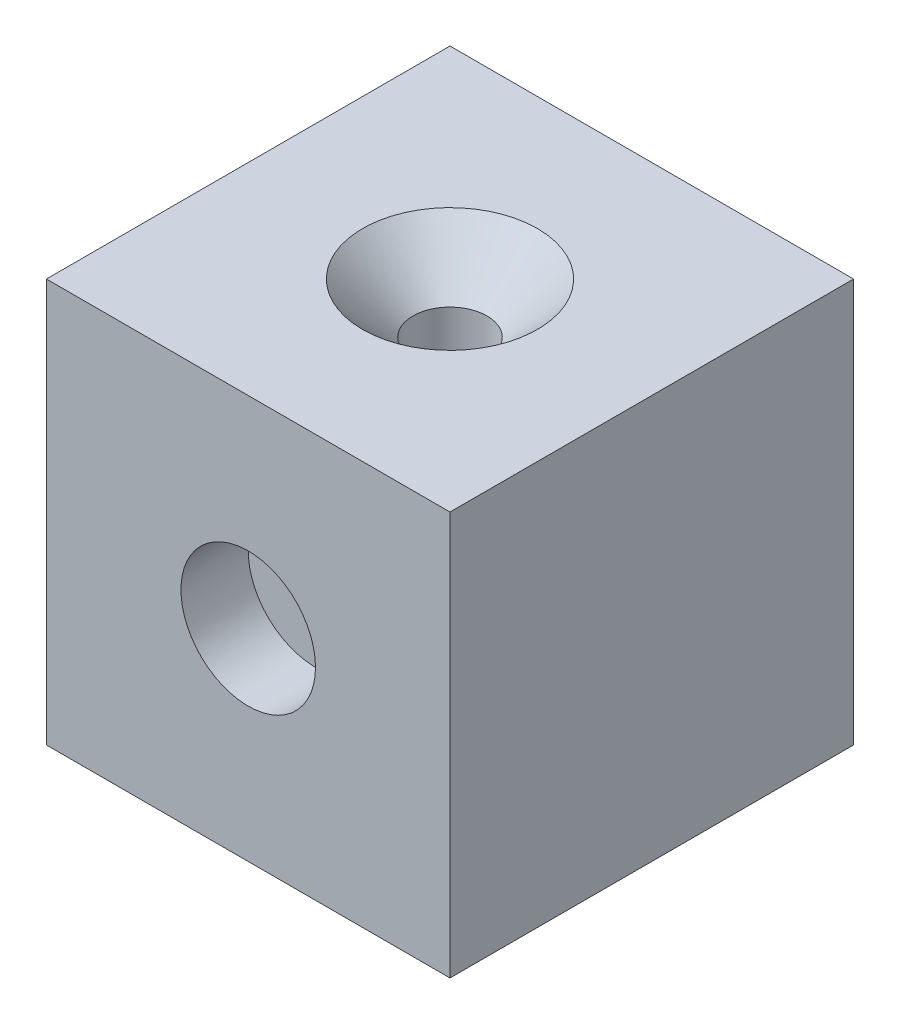
from build123d import *

# Parameters (mm, degrees)
SKETCH1_W           = 152.4
SKETCH1_H           = 152.4
BOSS_EXTRUDE1_DEPTH = 76.2
SKETCH4_R           = 25.4
CUT_EXTRUDE2_DEPTH  = 25.4
SKETCH5_R           = 25.4
BOSS_EXTRUDE2_DEPTH = 25.4
SKETCH6_W           = 127
SKETCH6_H           = 127
CUT_EXTRUDE3_DEPTH  = 12.7


with BuildPart() as part:
    # Sketch1 → Boss-Extrude1 (new, symmetric)
    with BuildSketch(Plane(origin=(0, 0, 0), x_dir=(1, 0, 0), z_dir=(0, 1, 0))):
        Rectangle(SKETCH1_W, SKETCH1_H)
    extrude(amount=BOSS_EXTRUDE1_DEPTH, both=True)

    # Sketch2 → Cut-Revolve1 (revolve, cut)
    with BuildSketch(Plane.XY, mode=Mode.PRIVATE) as cut_revolve1_sk:
        Polygon((0, 12.7), (13.97, 12.7), (13.97, 57.15), (33.02, 76.2), (0, 76.2), align=None)
    revolve(cut_revolve1_sk.sketch.rotate(Axis((0, 0, 0), (0, 1, 0)), 90), axis=Axis((0, 0, 0), (0, 1, 0)), mode=Mode.SUBTRACT)

    # Sketch4 → Cut-Extrude2 (cut)
    with BuildSketch(Plane.XY.offset(76.2)):
        Circle(SKETCH4_R)
    extrude(amount=-CUT_EXTRUDE2_DEPTH, mode=Mode.SUBTRACT)

    # Sketch5 → Boss-Extrude2 (add)
    with BuildSketch(Plane(origin=(0, 0, -76.2), x_dir=(-1, 0, 0), z_dir=(0, 0, -1))):
        with Locations(Location((0, 0, 0), (0, 0, 180))):
            Circle(SKETCH5_R)
    extrude(amount=BOSS_EXTRUDE2_DEPTH)

    # Sketch6 → Cut-Extrude3 (cut)
    with BuildSketch(Plane.ZY.offset(76.2)):
        Rectangle(SKETCH6_W, SKETCH6_H)
    extrude(amount=-CUT_EXTRUDE3_DEPTH, mode=Mode.SUBTRACT)


solid = part.part
